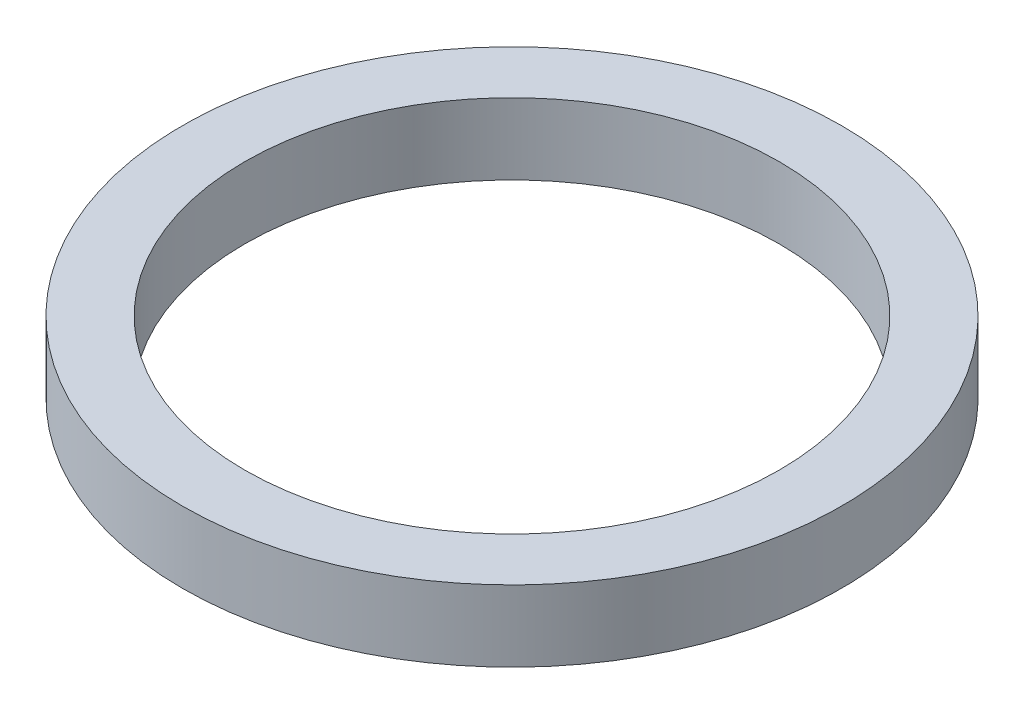
from build123d import *

# Parameters (mm, degrees)
SKETCH1_R           = 18.5
SKETCH1_R_2         = 15
BOSS_EXTRUDE1_DEPTH = 4


with BuildPart() as part:
    # Sketch1 → Boss-Extrude1 (new body)
    with BuildSketch(Plane(origin=(0, 0, 0), x_dir=(1, 0, 0), z_dir=(0, 1, 0))):
        with Locations(Location((0, 0, 0), (0, 0, 270))):
            Circle(SKETCH1_R)
        with Locations(Location((0, 0, 0), (0, 0, 270))):
            Circle(SKETCH1_R_2, mode=Mode.SUBTRACT)
    extrude(amount=BOSS_EXTRUDE1_DEPTH)


solid = part.part
